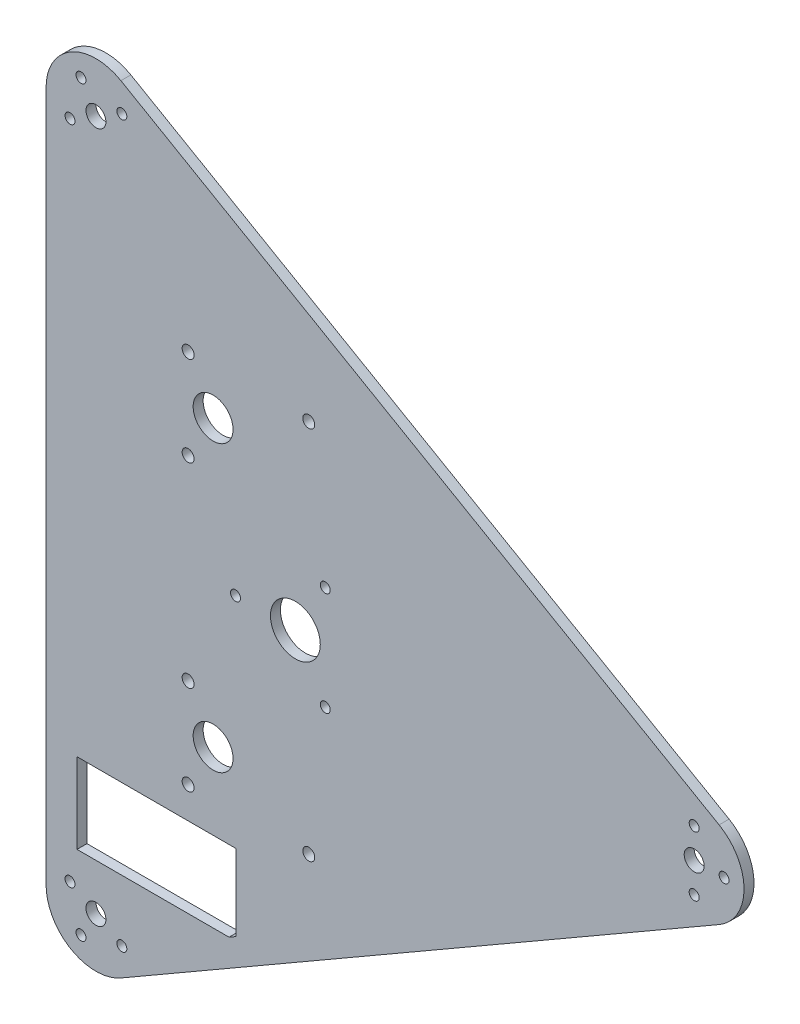
from build123d import *

# Parameters (mm, degrees)
BOARD_DEPTH        = 1
ESC_DEPTH          = 60.97841413
HOLE1SKE_R         = 0.5
HOLE1SKE_R_2       = 2.5
HOLE1_DEPTH        = 60.97841413
HOLE2SKE_R         = 1
HOLE2_DEPTH        = 60.97841413
HOLE3SKE_R         = 0.5
HOLE3_DEPTH        = 60.97841413
MOTORSETSKE_R      = 2
MOTORSET_DEPTH     = 60.97841413
MOTORSETHOLESKE_R  = 0.6
MOTORSETHOLE_DEPTH = 60.97841413


with BuildPart() as part:
    # BoardSke → Board (new body)
    with BuildSketch(Plane.XY):
        with BuildLine():
            Line((42.5, 4.330127019), (-17.5, 38.97114317))
            ThreePointArc((-17.5, 38.97114317), (-22.5, 38.97114317), (-25, 34.641016151))
            Line((-25, 34.641016151), (-25, -34.641016151))
            ThreePointArc((-25, -34.641016151), (-22.5, -38.97114317), (-17.5, -38.97114317))
            Line((-17.5, -38.97114317), (42.5, -4.330127019))
            ThreePointArc((42.5, -4.330127019), (45, 0), (42.5, 4.330127019))
        make_face()
    extrude(amount=BOARD_DEPTH)

    # ESCSke → ESC (cut, through all)
    with BuildSketch(Plane.XY.offset(1)):
        Polygon((-6.65, -30), (-21.9, -30), (-21.9, -21.951), (-5.95, -21.951), (-5.95, -29.6), align=None)
    extrude(amount=-ESC_DEPTH, mode=Mode.SUBTRACT)

    # Hole1Ske → Hole1 (cut, through all)
    with BuildSketch(Plane.XY.offset(1)):
        with Locations((-6, 0)):
            Circle(HOLE1SKE_R)
        with Locations((3, 5.196152423)):
            Circle(HOLE1SKE_R)
        with Locations((3, -5.196152423)):
            Circle(HOLE1SKE_R)
        Circle(HOLE1SKE_R_2)
    extrude(amount=-HOLE1_DEPTH, mode=Mode.SUBTRACT)

    # Hole2Ske → Hole2 (cut, through all)
    with BuildSketch(Plane.XY.offset(1)):
        with Locations((40, 0)):
            Circle(HOLE2SKE_R)
        with Locations((-20, -34.641016151)):
            Circle(HOLE2SKE_R)
        with Locations((-20, 34.641016151)):
            Circle(HOLE2SKE_R)
    extrude(amount=-HOLE2_DEPTH, mode=Mode.SUBTRACT)

    # Hole3Ske → Hole3 (cut, through all)
    with BuildSketch(Plane.XY.offset(1)):
        with Locations((40, 3)):
            Circle(HOLE3SKE_R)
        with Locations((40, -3)):
            Circle(HOLE3SKE_R)
        with Locations((-22.598076211, -33.141016151)):
            Circle(HOLE3SKE_R)
        with Locations((-17.401923789, -36.141016151)):
            Circle(HOLE3SKE_R)
        with Locations((-17.401923789, 36.141016151)):
            Circle(HOLE3SKE_R)
        with Locations((-22.598076211, 33.141016151)):
            Circle(HOLE3SKE_R)
        with Locations((43, 0)):
            Circle(HOLE3SKE_R)
        with Locations((-21.5, -37.239092363)):
            Circle(HOLE3SKE_R)
        with Locations((-21.5, 37.239092363)):
            Circle(HOLE3SKE_R)
    extrude(amount=-HOLE3_DEPTH, mode=Mode.SUBTRACT)

    # MotorSetSke → MotorSet (cut, through all)
    with BuildSketch(Plane.XY.offset(1)):
        with Locations((-8.25, 14.289419162)):
            Circle(MOTORSETSKE_R)
    motorset = extrude(amount=-MOTORSET_DEPTH, mode=Mode.SUBTRACT)

    # MotorSetHoleSke → MotorSetHole (cut, through all)
    with BuildSketch(Plane.XY.offset(1)):
        with Locations((-10.754495957, 18.789419162)):
            Circle(MOTORSETHOLESKE_R)
        with Locations((-10.754495957, 9.789419162)):
            Circle(MOTORSETHOLESKE_R)
        with Locations((1.345504043, 18.789419162)):
            Circle(MOTORSETHOLESKE_R)
    motorsethole = extrude(amount=-MOTORSETHOLE_DEPTH, mode=Mode.SUBTRACT)

    # Mirror 2: MotorSet, MotorSetHole across plane
    add(motorset.mirror(Plane.ZX), mode=Mode.SUBTRACT)
    add(motorsethole.mirror(Plane.ZX), mode=Mode.SUBTRACT)


solid = part.part
